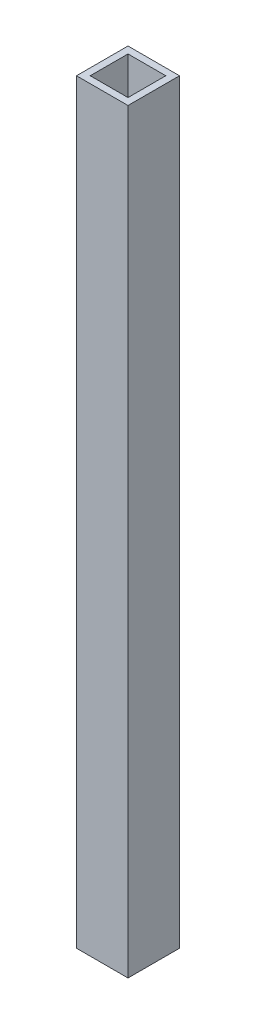
from build123d import *

# Parameters (mm, degrees)
SKETCH1_W           = 15
SKETCH1_H           = 15
SKETCH1_W_2         = 11
SKETCH1_H_2         = 11
BOSS_EXTRUDE1_DEPTH = 220


with BuildPart() as part:
    # Sketch1 → Boss-Extrude1 (new body)
    with BuildSketch(Plane(origin=(0, 0, 0), x_dir=(1, 0, 0), z_dir=(0, 1, 0))):
        with Locations((7.5, 7.5)):
            Rectangle(SKETCH1_W, SKETCH1_H)
        with Locations((7.5, 7.5)):
            Rectangle(SKETCH1_W_2, SKETCH1_H_2, mode=Mode.SUBTRACT)
    extrude(amount=BOSS_EXTRUDE1_DEPTH)


solid = part.part
